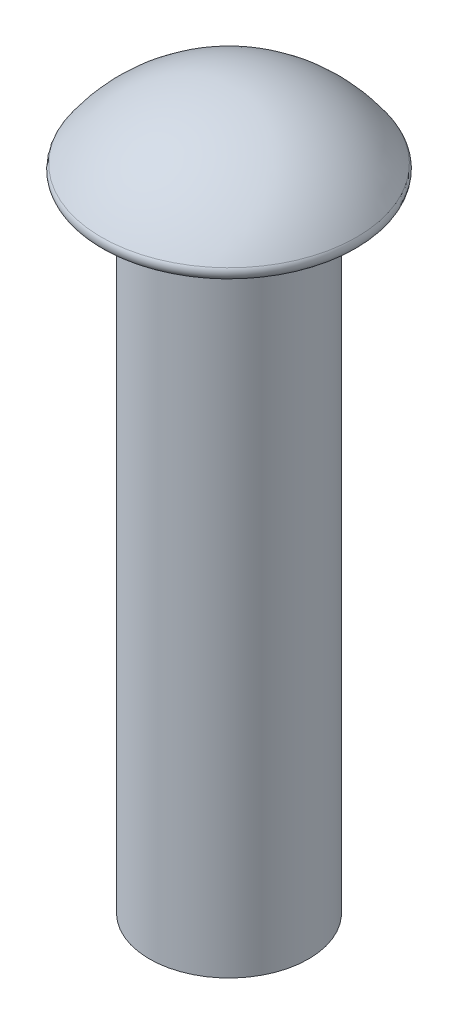
from build123d import *

# Parameters (mm, degrees)
FILLET1_R = 0.1


with BuildPart() as part:
    # Sketch1 → Revolve1 (revolve)
    with BuildSketch(Plane.XY):
        with BuildLine():
            Line((0, -4.5), (0, 4.5))
            ThreePointArc((0, 4.5), (0.986154146, 4.231462048), (1.7, 3.5))
            Line((1.7, 3.5), (1, 3.5))
            Line((1, 3.5), (1, -4.5))
            Line((1, -4.5), (0, -4.5))
        make_face()
    revolve(axis=Axis((0, -4.5, 0), (0, 1, 0)))

    # Fillet1
    fillet1_edges = [part.edges().sort_by_distance(p)[0] for p in [
        (-1.7, 3.5, 0),
    ]]
    fillet(fillet1_edges, radius=FILLET1_R)


solid = part.part
